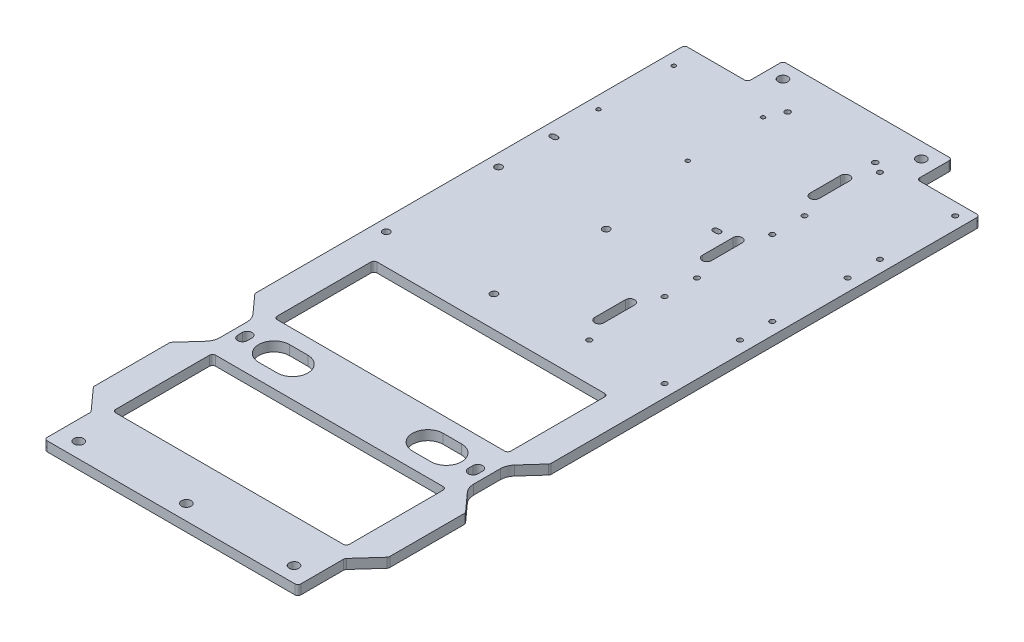
from build123d import *

# Parameters (mm, degrees)
SKETCH1_W           = 165
SKETCH1_H           = 430
BOSS_EXTRUDE1_DEPTH = 6.25
SKETCH2_W           = 110
SKETCH2_H           = 46
BOSS_EXTRUDE2_DEPTH = 6.25
SKETCH3_R           = 3.15
CUT_EXTRUDE1_DEPTH  = 252.97085645
CUT_EXTRUDE3_DEPTH  = 252.97085645
SKETCH4_W           = 152
SKETCH4_H           = 65
CUT_EXTRUDE2_DEPTH  = 252.97085645
BOSS_EXTRUDE3_DEPTH = 6.25
CUT_EXTRUDE4_DEPTH  = 257.708127063
SKETCH14_W          = 13.5
SKETCH14_H          = 229.5
BOSS_EXTRUDE4_DEPTH = 6.25
FILLET1_R           = 2
SKETCH8_R           = 1.65
CUT_EXTRUDE5_DEPTH  = 257.708127063
CUT_EXTRUDE8_DEPTH  = 257.708127063
LPATTERN1_COUNT     = 3
LPATTERN1_PITCH     = 70
SKETCH9_R           = 2.25
CUT_EXTRUDE6_DEPTH  = 257.708127063
SKETCH10_R          = 1.3
CUT_EXTRUDE7_DEPTH  = 257.708127063
FILLET2_R           = 10
SKETCH13_R          = 3.15
CUT_EXTRUDE9_DEPTH  = 257.708127063
CUT_EXTRUDE10_DEPTH = 257.708127063
FILLET3_R           = 2
SKETCH16_R          = 1.75
CUT_EXTRUDE11_DEPTH = 257.708127063


with BuildPart() as part:
    # Sketch1 → Boss-Extrude1 (new body)
    with BuildSketch(Plane(origin=(0, 0, 0), x_dir=(1, 0, 0), z_dir=(0, 1, 0))):
        Rectangle(SKETCH1_W, SKETCH1_H)
    extrude(amount=BOSS_EXTRUDE1_DEPTH)

    # Sketch2 → Boss-Extrude2 (add)
    with BuildSketch(Plane(origin=(0, 6.25, 0), x_dir=(1, 0, 0), z_dir=(0, 1, 0))):
        with Locations((0, 215)):
            Rectangle(SKETCH2_W, SKETCH2_H)
    extrude(amount=-BOSS_EXTRUDE2_DEPTH)

    # Sketch3 → Cut-Extrude1 (cut, through all)
    with BuildSketch(Plane(origin=(0, 6.25, 0), x_dir=(1, 0, 0), z_dir=(0, 1, 0))):
        with Locations(Location((-45, 228, 0), (0, 0, 270))):
            Circle(SKETCH3_R)
        with Locations(Location((45, 228, 0), (0, 0, 270))):
            Circle(SKETCH3_R)
    extrude(amount=-CUT_EXTRUDE1_DEPTH, mode=Mode.SUBTRACT)

    # Sketch5 → Cut-Extrude3 (cut, through all)
    with BuildSketch(Plane(origin=(0, 6.25, 0), x_dir=(1, 0, 0), z_dir=(0, 1, 0))):
        with BuildLine():
            Line((-78.15, -93.5), (-78.15, -90.5))
            ThreePointArc((-78.15, -90.5), (-75, -87.35), (-71.85, -90.5))
            Line((-71.85, -90.5), (-71.85, -93.5))
            ThreePointArc((-71.85, -93.5), (-75, -96.65), (-78.15, -93.5))
        make_face()
        with BuildLine():
            Line((71.85, -93.5), (71.85, -90.5))
            ThreePointArc((71.85, -90.5), (75, -87.35), (78.15, -90.5))
            Line((78.15, -90.5), (78.15, -93.5))
            ThreePointArc((78.15, -93.5), (75, -96.65), (71.85, -93.5))
        make_face()
    extrude(amount=-CUT_EXTRUDE3_DEPTH, mode=Mode.SUBTRACT)

    # Sketch4 → Cut-Extrude2 (cut, through all)
    with BuildSketch(Plane(origin=(0, 6.25, 0), x_dir=(1, 0, 0), z_dir=(0, 1, 0))):
        with Locations((0, -39.5)):
            Rectangle(SKETCH4_W, SKETCH4_H)
        with Locations((0, -144.5)):
            Rectangle(SKETCH4_W, SKETCH4_H)
    extrude(amount=-CUT_EXTRUDE2_DEPTH, mode=Mode.SUBTRACT)

    # Sketch6 → Boss-Extrude3 (add)
    with BuildSketch(Plane(origin=(0, 6.25, 0), x_dir=(1, 0, 0), z_dir=(0, 1, 0))):
        Polygon((82.5, 0.5), (82.5, -79.5), (96, -64.5), (96, -14.5), align=None)
        Polygon((82.5, -104.5), (82.5, -184.5), (96, -169.5), (96, -119.5), align=None)
    boss_extrude3 = extrude(amount=-BOSS_EXTRUDE3_DEPTH)

    # Sketch7 → Cut-Extrude4 (cut, through all)
    with BuildSketch(Plane(origin=(0, 6.25, 0), x_dir=(1, 0, 0), z_dir=(0, 1, 0))):
        with BuildLine():
            Line((44, -82), (56, -82))
            ThreePointArc((56, -82), (66, -92), (56, -102))
            Line((56, -102), (44, -102))
            ThreePointArc((44, -102), (34, -92), (44, -82))
        make_face()
    cut_extrude4 = extrude(amount=-CUT_EXTRUDE4_DEPTH, mode=Mode.SUBTRACT)

    # Sketch14 → Boss-Extrude4 (add)
    with BuildSketch(Plane(origin=(0, 6.25, 0), x_dir=(1, 0, 0), z_dir=(0, 1, 0))):
        with Locations((89.25, 100.25)):
            Rectangle(SKETCH14_W, SKETCH14_H)
    boss_extrude4 = extrude(amount=-BOSS_EXTRUDE4_DEPTH)

    # Mirror1: Boss-Extrude3, Cut-Extrude4, Boss-Extrude4 across plane
    add(boss_extrude3.mirror(Plane(origin=(0, 0, 0), x_dir=(0, 0, 1), z_dir=(1, 0, 0))))
    add(cut_extrude4.mirror(Plane(origin=(0, 0, 0), x_dir=(0, 0, 1), z_dir=(1, 0, 0))), mode=Mode.SUBTRACT)
    add(boss_extrude4.mirror(Plane(origin=(0, 0, 0), x_dir=(0, 0, 1), z_dir=(1, 0, 0))))

    # Fillet1
    fillet1_edges = [part.edges().sort_by_distance(p)[0] for p in [
        (76, 3.125, 7),
        (76, 3.125, 72),
        (-76, 3.125, 72),
        (-76, 3.125, 7),
        (76, 3.125, 112),
        (76, 3.125, 177),
        (-76, 3.125, 177),
        (-76, 3.125, 112),
    ]]
    fillet(fillet1_edges, radius=FILLET1_R)

    # Sketch8 → Cut-Extrude5 (cut, through all)
    with BuildSketch(Plane(origin=(0, 6.25, 0), x_dir=(1, 0, 0), z_dir=(0, 1, 0))):
        with Locations(Location((39, 207, 0), (0, 0, 270))):
            Circle(SKETCH8_R)
        with Locations(Location((88, 207, 0), (0, 0, 270))):
            Circle(SKETCH8_R)
        with Locations(Location((88, 158, 0), (0, 0, 270))):
            Circle(SKETCH8_R)
        with Locations(Location((39, 158, 0), (0, 0, 270))):
            Circle(SKETCH8_R)
    cut_extrude5 = extrude(amount=-CUT_EXTRUDE5_DEPTH, mode=Mode.SUBTRACT)

    # Sketch12 → Cut-Extrude8 (cut, through all)
    with BuildSketch(Plane(origin=(0, 6.25, 0), x_dir=(1, 0, 0), z_dir=(0, 1, 0))):
        with BuildLine():
            Line((28, 172.5), (28, 192.5))
            ThreePointArc((28, 192.5), (31, 195.5), (34, 192.5))
            Line((34, 192.5), (34, 172.5))
            ThreePointArc((34, 172.5), (31, 169.5), (28, 172.5))
        make_face()
    cut_extrude8 = extrude(amount=-CUT_EXTRUDE8_DEPTH, mode=Mode.SUBTRACT)

    # LPattern1: Cut-Extrude5, Cut-Extrude8 ×3
    with Locations(*[(0, 0, i * LPATTERN1_PITCH) for i in range(1, LPATTERN1_COUNT)]):
        add(cut_extrude5, mode=Mode.SUBTRACT)
        add(cut_extrude8, mode=Mode.SUBTRACT)

    # Sketch9 → Cut-Extrude6 (cut, through all)
    with BuildSketch(Plane(origin=(0, 6.25, 0), x_dir=(1, 0, 0), z_dir=(0, 1, 0))):
        with Locations(Location((-88, 86, 0), (0, 0, 270))):
            Circle(SKETCH9_R)
        with Locations(Location((-18, 86, 0), (0, 0, 270))):
            Circle(SKETCH9_R)
        with Locations(Location((-88, 13, 0), (0, 0, 270))):
            Circle(SKETCH9_R)
        with Locations(Location((-18, 13, 0), (0, 0, 270))):
            Circle(SKETCH9_R)
    extrude(amount=-CUT_EXTRUDE6_DEPTH, mode=Mode.SUBTRACT)

    # Sketch10 → Cut-Extrude7 (cut, through all)
    with BuildSketch(Plane(origin=(0, 6.25, 0), x_dir=(1, 0, 0), z_dir=(0, 1, 0))):
        with Locations(Location((-88, 200, 0), (0, 0, 270))):
            Circle(SKETCH10_R)
        with Locations(Location((-30, 200, 0), (0, 0, 270))):
            Circle(SKETCH10_R)
        with Locations(Location((-88, 151, 0), (0, 0, 270))):
            Circle(SKETCH10_R)
        with Locations(Location((-30, 151, 0), (0, 0, 270))):
            Circle(SKETCH10_R)
    extrude(amount=-CUT_EXTRUDE7_DEPTH, mode=Mode.SUBTRACT)

    # Fillet2
    fillet2_edges = [part.edges().sort_by_distance(p)[0] for p in [
        (82.5, 3.125, 79.5),
        (82.5, 3.125, 104.5),
        (-82.5, 3.125, 79.5),
        (-82.5, 3.125, 104.5),
    ]]
    fillet(fillet2_edges, radius=FILLET2_R)

    # Sketch13 → Cut-Extrude9 (cut, through all)
    with BuildSketch(Plane(origin=(0, 6.25, 0), x_dir=(1, 0, 0), z_dir=(0, 1, 0))):
        with Locations(Location((-70, -205, 0), (0, 0, 270))):
            Circle(SKETCH13_R)
        with Locations(Location((70, -205, 0), (0, 0, 270))):
            Circle(SKETCH13_R)
        with Locations(Location((0, -205, 0), (0, 0, 270))):
            Circle(SKETCH13_R)
    extrude(amount=-CUT_EXTRUDE9_DEPTH, mode=Mode.SUBTRACT)

    # Sketch15 → Cut-Extrude10 (cut, through all)
    with BuildSketch(Plane(origin=(0, 6.25, 0), x_dir=(1, 0, 0), z_dir=(0, 1, 0))):
        with BuildLine():
            Line((-88, 122.65), (-86, 122.65))
            ThreePointArc((-86, 122.65), (-84.35, 121), (-86, 119.35))
            Line((-86, 119.35), (-88, 119.35))
            ThreePointArc((-88, 119.35), (-89.65, 121), (-88, 122.65))
        make_face()
        with BuildLine():
            Line((20, 119.35), (18, 119.35))
            ThreePointArc((18, 119.35), (16.35, 121), (18, 122.65))
            Line((18, 122.65), (20, 122.65))
            ThreePointArc((20, 122.65), (21.65, 121), (20, 119.35))
        make_face()
    extrude(amount=-CUT_EXTRUDE10_DEPTH, mode=Mode.SUBTRACT)

    # Fillet3
    fillet3_edges = [part.edges().sort_by_distance(p)[0] for p in [
        (96, 3.125, 64.5),
        (82.5, 3.125, 184.5),
        (96, 3.125, 169.5),
        (96, 3.125, 119.5),
        (96, 3.125, -215),
        (-96, 3.125, 64.5),
        (-96, 3.125, 119.5),
        (-82.5, 3.125, 184.5),
        (-96, 3.125, 169.5),
        (55, 3.125, -238),
        (-96, 3.125, -215),
        (-55, 3.125, -238),
        (-55, 3.125, -215),
        (55, 3.125, -215),
        (82.5, 3.125, 215),
        (-82.5, 3.125, 215),
    ]]
    fillet(fillet3_edges, radius=FILLET3_R)

    # Sketch16 → Cut-Extrude11 (cut, through all)
    with BuildSketch(Plane(origin=(0, 6.25, 0), x_dir=(1, 0, 0), z_dir=(0, 1, 0))):
        with Locations(Location((-25, 211, 0), (0, 0, 270))):
            Circle(SKETCH16_R)
        with Locations(Location((32, 211, 0), (0, 0, 270))):
            Circle(SKETCH16_R)
    extrude(amount=-CUT_EXTRUDE11_DEPTH, mode=Mode.SUBTRACT)


solid = part.part
